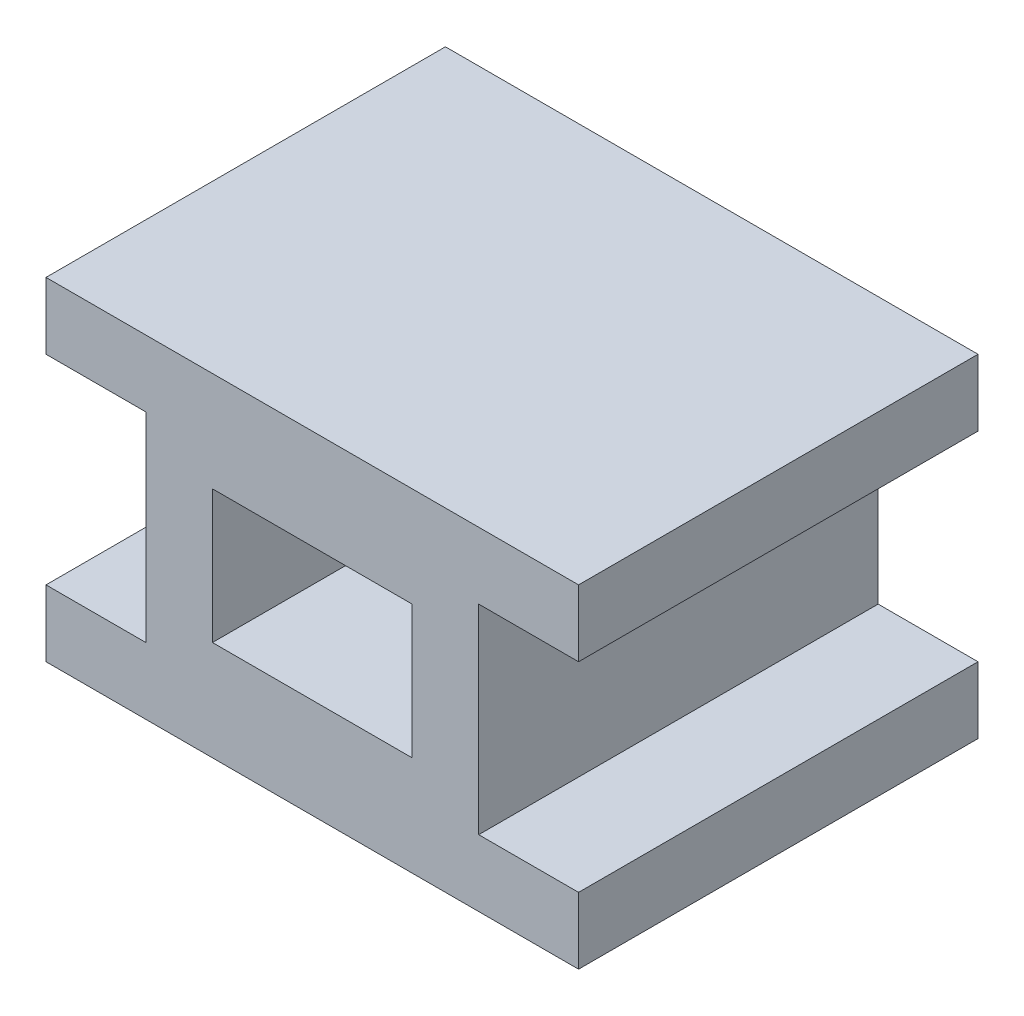
from build123d import *

# Parameters (mm, degrees)
SKETCH1_W           = 30
SKETCH1_H           = 20
BOSS_EXTRUDE1_DEPTH = 30


with BuildPart() as part:
    # Sketch1 → Boss-Extrude1 (new, symmetric)
    with BuildSketch(Plane.XY):
        Polygon((33.229508197, -36.442622951), (-46.770491803, -36.442622951), (-46.770491803, -26.442622951), (-31.770491803, -26.442622951), (-31.770491803, 3.557377049), (-46.770491803, 3.557377049), (-46.770491803, 13.557377049), (33.229508197, 13.557377049), (33.229508197, 3.557377049), (18.229508197, 3.557377049), (18.229508197, -26.442622951), (33.229508197, -26.442622951), align=None)
        with Locations((-6.770491803, -11.442622951)):
            Rectangle(SKETCH1_W, SKETCH1_H, mode=Mode.SUBTRACT)
    extrude(amount=BOSS_EXTRUDE1_DEPTH, both=True)


solid = part.part
